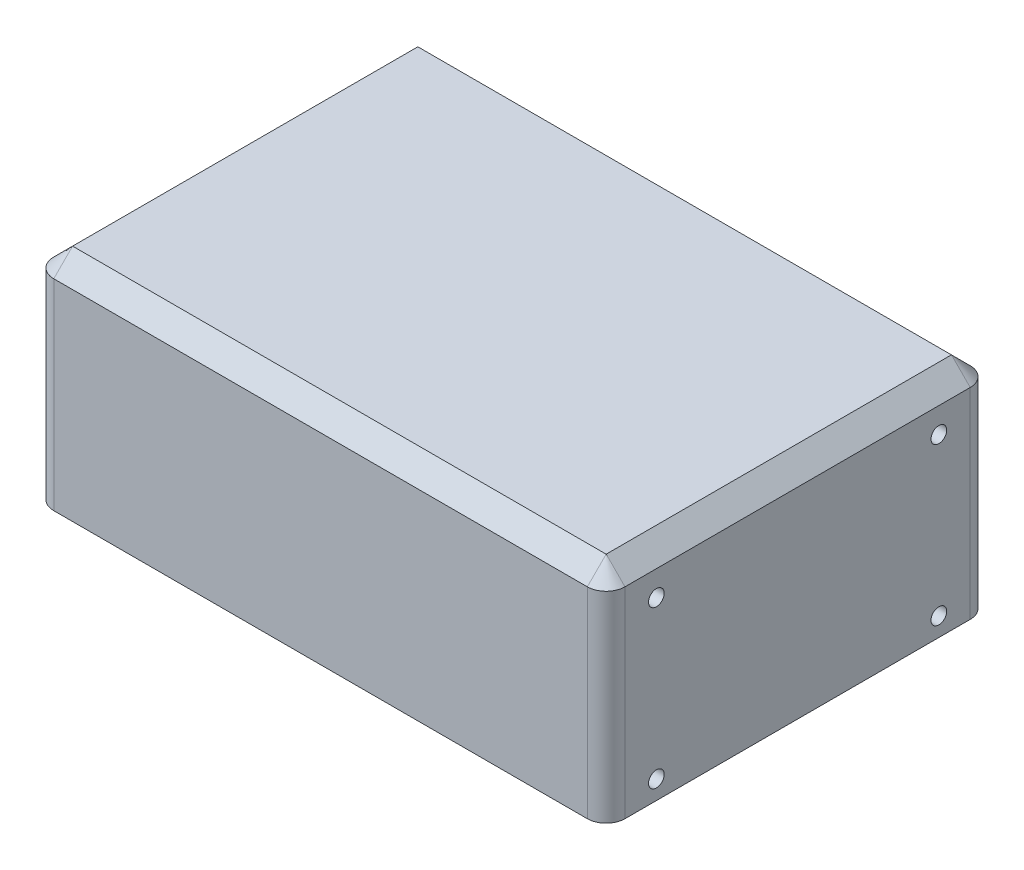
from build123d import *

# Parameters (mm, degrees)
SKETCH1_W           = 91
SKETCH1_H           = 61
BOSS_EXTRUDE1_DEPTH = 35
SKETCH2_R           = 1.25
CUT_EXTRUDE1_DEPTH  = 8
CUT_EXTRUDE2_START  = -83
SKETCH2_2_R         = 1.25
CUT_EXTRUDE2_DEPTH  = 8
FILLET2_R           = 3
CHAMFER1_SIZE       = 3
SKETCH3_R           = 1.25
CUT_EXTRUDE3_DEPTH  = 10


with BuildPart() as part:
    # Sketch1 → Boss-Extrude1 (new body)
    with BuildSketch(Plane(origin=(0, 0, 0), x_dir=(1, 0, 0), z_dir=(0, 1, 0))):
        with Locations((-45.5, -30.5)):
            Rectangle(SKETCH1_W, SKETCH1_H)
    extrude(amount=BOSS_EXTRUDE1_DEPTH)

    # Sketch2 → Cut-Extrude1 (cut)
    with BuildSketch(Plane(origin=(0, 0, 0), x_dir=(0, 0, -1), z_dir=(1, 0, 0))):
        with Locations((-8, 28)):
            Circle(SKETCH2_R)
        with Locations((-8, 3)):
            Circle(SKETCH2_R)
        with Locations(Location((-53, 3, 0), (0, 0, 180))):
            Circle(SKETCH2_R)
        with Locations(Location((-53, 28, 0), (0, 0, 180))):
            Circle(SKETCH2_R)
    extrude(amount=-CUT_EXTRUDE1_DEPTH, mode=Mode.SUBTRACT)

    # Sketch2<2> → Cut-Extrude2 (cut)
    with BuildSketch(Plane(origin=(0, 0, 0), x_dir=(0, 0, -1), z_dir=(1, 0, 0)).offset(CUT_EXTRUDE2_START)):
        with Locations((-8, 28)):
            Circle(SKETCH2_2_R)
        with Locations((-8, 3)):
            Circle(SKETCH2_2_R)
        with Locations(Location((-53, 3, 0), (0, 0, 180))):
            Circle(SKETCH2_2_R)
        with Locations(Location((-53, 28, 0), (0, 0, 180))):
            Circle(SKETCH2_2_R)
    extrude(amount=-CUT_EXTRUDE2_DEPTH, mode=Mode.SUBTRACT)

    # Fillet2
    fillet2_edges = [part.edges().sort_by_distance(p)[0] for p in [
        (0, 17.5, 61),
        (-91, 17.5, 61),
        (-91, 17.5, 0),
        (0, 17.5, 0),
    ]]
    fillet(fillet2_edges, radius=FILLET2_R)

    # Chamfer1
    chamfer1_edges = [part.edges().sort_by_distance(p)[0] for p in [
        (-91, 35, 30.5),
        (-45.5, 35, 0),
        (0, 35, 30.5),
        (-45.5, 35, 61),
        (-90.121320344, 35, 60.121320344),
        (-0.878679656, 35, 60.121320344),
        (-0.878679656, 35, 0.878679656),
        (-90.121320344, 35, 0.878679656),
    ]]
    chamfer(chamfer1_edges, length=CHAMFER1_SIZE)

    # Sketch3 → Cut-Extrude3 (cut)
    with BuildSketch(Plane.XZ):
        with Locations(Location((-45.5, 44.5, 0), (0, 0, 270))):
            Circle(SKETCH3_R)
        with Locations(Location((-45.5, 16.5, 0), (0, 0, 270))):
            Circle(SKETCH3_R)
    extrude(amount=-CUT_EXTRUDE3_DEPTH, mode=Mode.SUBTRACT)


solid = part.part
